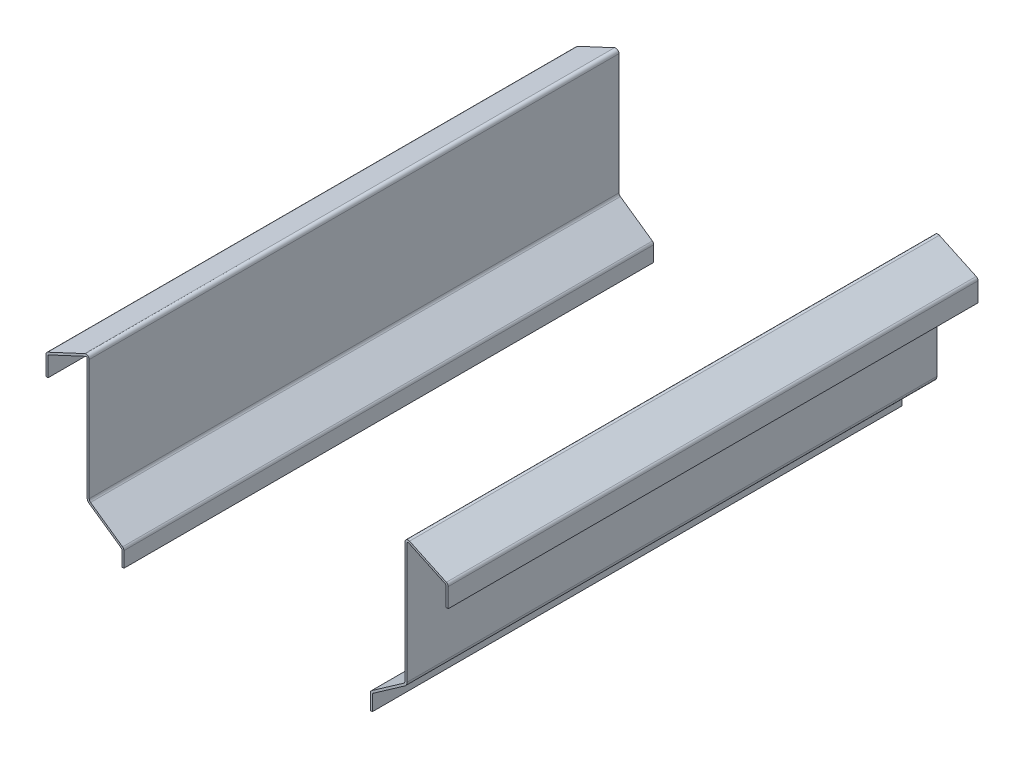
from build123d import *

# Parameters (mm, degrees)
BOSS_EXTRUDE1_DEPTH   = 500
BOSS_EXTRUDE1_2_DEPTH = 500


with BuildPart() as part:
    # Sketch1 → Boss-Extrude1 (new body)
    with BuildSketch(Plane.XY):
        with BuildLine():
            ThreePointArc((-118.233918228, -26.066459757), (-118.346907395, -25.604711144), (-118.660341792, -25.247307713))
            Line((-118.660341792, -25.247307713), (-148.867882182, -4.095760221))
            ThreePointArc((-148.867882182, -4.095760221), (-150.435054166, -2.308743066), (-151, 0))
            Line((-151, 0), (-151, 113.729242117))
            ThreePointArc((-151, 113.729242117), (-151.462700392, 114.572633563), (-152.422618262, 114.635549904))
            Line((-152.422618262, 114.635549904), (-187.206468678, 98.415574075))
            ThreePointArc((-187.206468678, 98.415574075), (-187.627241862, 98.046565896), (-187.783850417, 97.509266288))
            Line((-187.783850417, 97.509266288), (-187.783850417, 79.42047707))
            Line((-187.783850417, 79.42047707), (-189.783850417, 79.42047707))
            Line((-189.783850417, 79.42047707), (-189.783850417, 97.509266288))
            ThreePointArc((-189.783850417, 97.509266288), (-189.314024754, 99.121165113), (-188.051705202, 100.228189649))
            Line((-188.051705202, 100.228189649), (-153.267854785, 116.448165478))
            ThreePointArc((-153.267854785, 116.448165478), (-150.388101175, 116.259416454), (-149, 113.729242117))
            Line((-149, 113.729242117), (-149, 0))
            ThreePointArc((-149, 0), (-148.6610325, -1.38524584), (-147.720729309, -2.457456133))
            Line((-147.720729309, -2.457456133), (-117.513188919, -23.609003624))
            ThreePointArc((-117.513188919, -23.609003624), (-116.572885729, -24.681213918), (-116.233918228, -26.066459757))
            Line((-116.233918228, -26.066459757), (-116.233918228, -40.504758606))
            Line((-116.233918228, -40.504758606), (-118.233918228, -40.504758606))
            Line((-118.233918228, -40.504758606), (-118.233918228, -26.066459757))
        make_face()
    extrude(amount=BOSS_EXTRUDE1_DEPTH)


with BuildPart() as body_2:
    # Sketch1 → Boss-Extrude1 2 (new body)
    with BuildSketch(Plane.XY):
        with BuildLine():
            ThreePointArc((116.233918228, -26.066459757), (116.572885729, -24.681213918), (117.513188919, -23.609003624))
            Line((117.513188919, -23.609003624), (147.720729309, -2.457456133))
            ThreePointArc((147.720729309, -2.457456133), (148.6610325, -1.38524584), (149, 0))
            Line((149, 0), (149, 113.729242117))
            ThreePointArc((149, 113.729242117), (150.388101175, 116.259416454), (153.267854785, 116.448165478))
            Line((153.267854785, 116.448165478), (188.051705202, 100.228189649))
            ThreePointArc((188.051705202, 100.228189649), (189.314024754, 99.121165113), (189.783850417, 97.509266288))
            Line((189.783850417, 97.509266288), (189.783850417, 79.42047707))
            Line((189.783850417, 79.42047707), (187.783850417, 79.42047707))
            Line((187.783850417, 79.42047707), (187.783850417, 97.509266288))
            ThreePointArc((187.783850417, 97.509266288), (187.627241862, 98.046565896), (187.206468678, 98.415574075))
            Line((187.206468678, 98.415574075), (152.422618262, 114.635549904))
            ThreePointArc((152.422618262, 114.635549904), (151.462700392, 114.572633563), (151, 113.729242117))
            Line((151, 113.729242117), (151, 0))
            ThreePointArc((151, 0), (150.435054166, -2.308743066), (148.867882182, -4.095760221))
            Line((148.867882182, -4.095760221), (118.660341792, -25.247307713))
            ThreePointArc((118.660341792, -25.247307713), (118.346907395, -25.604711144), (118.233918228, -26.066459757))
            Line((118.233918228, -26.066459757), (118.233918228, -40.504758606))
            Line((118.233918228, -40.504758606), (116.233918228, -40.504758606))
            Line((116.233918228, -40.504758606), (116.233918228, -26.066459757))
        make_face()
    extrude(amount=BOSS_EXTRUDE1_2_DEPTH)


solid = Compound([part.part, body_2.part])
